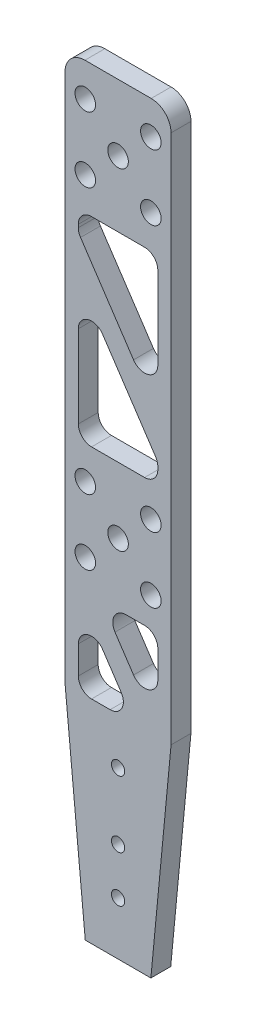
from build123d import *

# Parameters (mm, degrees)
SKETCH_1_R          = 1.55
EXTRUDE_1_DEPTH     = 3
SKETCH_2_W          = 30.67898901
SKETCH_2_H          = 20.291672983
CUT_EXTRUDE_1_DEPTH = 10
SKETCH_3_R          = 1
CUT_EXTRUDE_2_DEPTH = 20
CUT_EXTRUDE_3_DEPTH = 100.15206986
FILLET_1_R          = 2


with BuildPart() as part:
    # 草图1 → 凸台-拉伸1 (new body)
    with BuildSketch(Plane.XY):
        with BuildLine():
            Line((5, 16.216737463), (-5, 16.216737463))
            ThreePointArc((-5, 16.216737463), (-7.121320344, 15.338057806), (-8, 13.216737463))
            Line((-8, 13.216737463), (-8, -66.783262537))
            Line((-8, -66.783262537), (-4, -108.783262537))
            Line((-4, -108.783262537), (4, -108.783262537))
            Line((4, -108.783262537), (8, -66.783262537))
            Line((8, -66.783262537), (8, 13.216737463))
            ThreePointArc((8, 13.216737463), (7.121320344, 15.338057806), (5, 16.216737463))
        make_face()
        with Locations((-4.949747468, 11.166484931)):
            Circle(SKETCH_1_R, mode=Mode.SUBTRACT)
        with Locations((4.949747468, 11.166484931)):
            Circle(SKETCH_1_R, mode=Mode.SUBTRACT)
        with Locations((4.949747468, 1.266989995)):
            Circle(SKETCH_1_R, mode=Mode.SUBTRACT)
        with Locations((-4.949747468, 1.266989995)):
            Circle(SKETCH_1_R, mode=Mode.SUBTRACT)
        with Locations((0, -43.783262537)):
            Circle(SKETCH_1_R, mode=Mode.SUBTRACT)
        with Locations((4.949747468, -38.833515069)):
            Circle(SKETCH_1_R, mode=Mode.SUBTRACT)
        with Locations((-4.949747468, -38.833515069)):
            Circle(SKETCH_1_R, mode=Mode.SUBTRACT)
        with Locations((4.949747468, -48.733010005)):
            Circle(SKETCH_1_R, mode=Mode.SUBTRACT)
        with Locations((-4.949747468, -48.733010005)):
            Circle(SKETCH_1_R, mode=Mode.SUBTRACT)
        with Locations((0, 6.216737463)):
            Circle(SKETCH_1_R, mode=Mode.SUBTRACT)
    extrude(amount=EXTRUDE_1_DEPTH)

    # 草图2 → 切除-拉伸1 (cut)
    with BuildSketch(Plane(origin=(0, 0, 0), x_dir=(-1, 0, 0), z_dir=(0, 0, -1))):
        with Locations((1.230440634, -108.929099029)):
            Rectangle(SKETCH_2_W, SKETCH_2_H)
    extrude(amount=-CUT_EXTRUDE_1_DEPTH, mode=Mode.SUBTRACT)

    # 草图3 → 切除-拉伸2 (cut)
    with BuildSketch(Plane(origin=(0, 0, 0), x_dir=(-1, 0, 0), z_dir=(0, 0, -1))):
        with Locations((0, -83.783262537)):
            Circle(SKETCH_3_R)
        with Locations((0, -90.783262537)):
            Circle(SKETCH_3_R)
        with Locations((0, -73.783262537)):
            Circle(SKETCH_3_R)
    extrude(amount=-CUT_EXTRUDE_2_DEPTH, mode=Mode.SUBTRACT)

    # 草图4 → 切除-拉伸3 (cut, through all)
    with BuildSketch(Plane(origin=(0, 0, 0), x_dir=(-1, 0, 0), z_dir=(0, 0, -1))):
        Polygon((6, -12.783262537), (-6, -30.783262537), (-6, -33.833515069), (6, -33.833515069), align=None)
        Polygon((6, -3.733010005), (-6, -3.733010005), (-6, -24.783262537), (6, -6.783262537), align=None)
        Polygon((6, -66.783262537), (6, -53.976503319), (-2.537839478, -66.783262537), align=None)
        Polygon((-6, -65.976503319), (2.537839478, -53.169744102), (-6, -53.169744102), align=None)
    extrude(amount=-CUT_EXTRUDE_3_DEPTH, mode=Mode.SUBTRACT)

    # 圆角1
    fillet_1_edges = [part.edges().sort_by_distance(p)[0] for p in [
        (6, -30.783262537, 1.5),
        (-6, -12.783262537, 1.5),
        (-6, -33.833515069, 1.5),
        (6, -33.833515069, 1.5),
        (-2.537839478, -53.169744102, 1.5),
        (6, -65.976503319, 1.5),
        (6, -53.169744102, 1.5),
        (-6, -53.976503319, 1.5),
        (-6, -66.783262537, 1.5),
        (2.537839478, -66.783262537, 1.5),
        (6, -24.783262537, 1.5),
        (6, -3.733010005, 1.5),
        (-6, -3.733010005, 1.5),
        (-6, -6.783262537, 1.5),
    ]]
    fillet(fillet_1_edges, radius=FILLET_1_R)


solid = part.part
